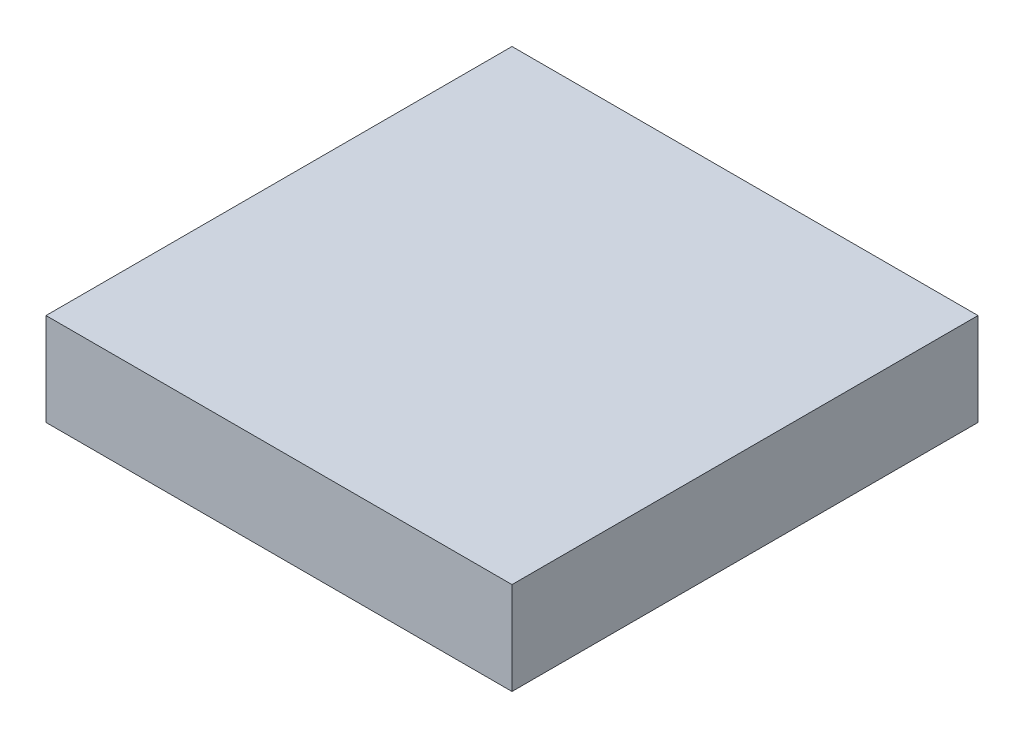
from build123d import *

# Parameters (mm, degrees)
SKETCH1_W           = 15.85
SKETCH1_H           = 15.85
BOSS_EXTRUDE1_DEPTH = 3.15
SHELL1_T            = -1.5
SKETCH2_R           = 3.225
SKETCH2_R_2         = 2.425
BOSS_EXTRUDE2_DEPTH = 1.45


with BuildPart() as part:
    # Sketch1 → Boss-Extrude1 (new body)
    with BuildSketch(Plane(origin=(0, 0, 0), x_dir=(1, 0, 0), z_dir=(0, 1, 0))):
        Rectangle(SKETCH1_W, SKETCH1_H)
    extrude(amount=-BOSS_EXTRUDE1_DEPTH)

    # Shell1
    shell1_openings = [part.faces().sort_by_distance(p)[0] for p in [
        (0, -3.15, 0),
    ]]
    offset(amount=SHELL1_T, openings=shell1_openings, kind=Kind.INTERSECTION)

    # Sketch2 → Boss-Extrude2 (add)
    with BuildSketch(Plane.XZ.offset(1.5)):
        with Locations(Location((0, 0, 0), (0, 0, 90))):
            Circle(SKETCH2_R)
        with Locations(Location((0, 0, 0), (0, 0, 90))):
            Circle(SKETCH2_R_2, mode=Mode.SUBTRACT)
    extrude(amount=BOSS_EXTRUDE2_DEPTH)


solid = part.part
